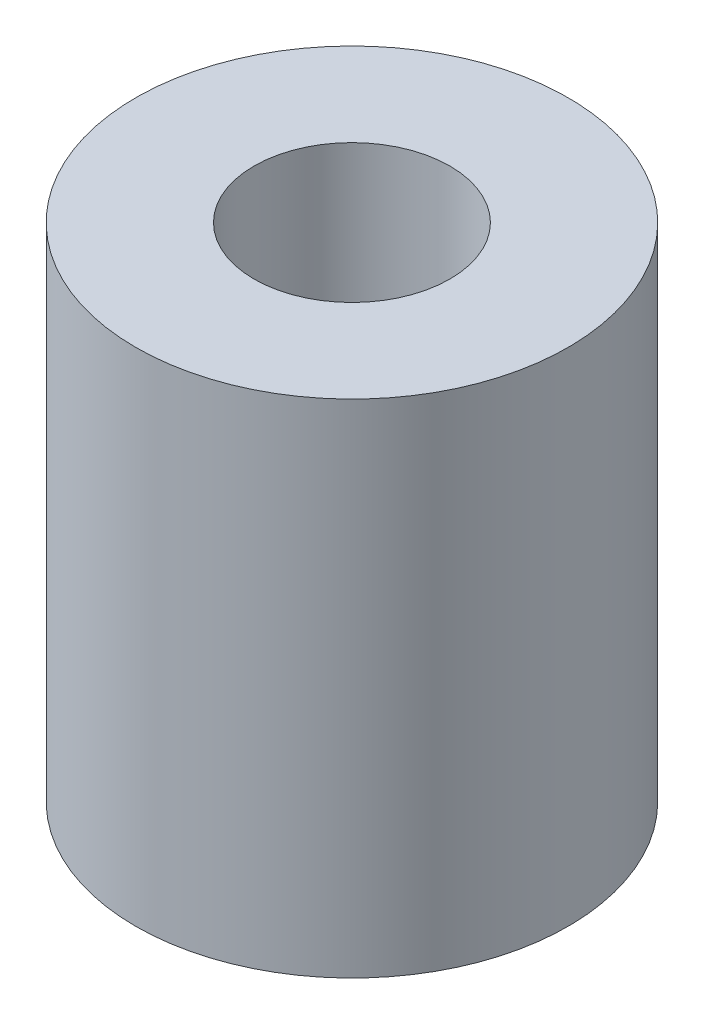
from build123d import *

# Parameters (mm, degrees)
SKETCH1_R           = 6.9
BOSS_EXTRUDE1_DEPTH = 16
SKETCH2_R           = 3.125
CUT_EXTRUDE1_DEPTH  = 14


with BuildPart() as part:
    # Sketch1 → Boss-Extrude1 (new body)
    with BuildSketch(Plane(origin=(0, 0, 0), x_dir=(1, 0, 0), z_dir=(0, 1, 0))):
        with Locations(Location((0, 0, 0), (0, 0, 270))):
            Circle(SKETCH1_R)
    extrude(amount=BOSS_EXTRUDE1_DEPTH)

    # Sketch2 → Cut-Extrude1 (cut)
    with BuildSketch(Plane(origin=(0, 16, 0), x_dir=(1, 0, 0), z_dir=(0, 1, 0))):
        with Locations(Location((0, 0, 0), (0, 0, 270))):
            Circle(SKETCH2_R)
    extrude(amount=-CUT_EXTRUDE1_DEPTH, mode=Mode.SUBTRACT)


solid = part.part
